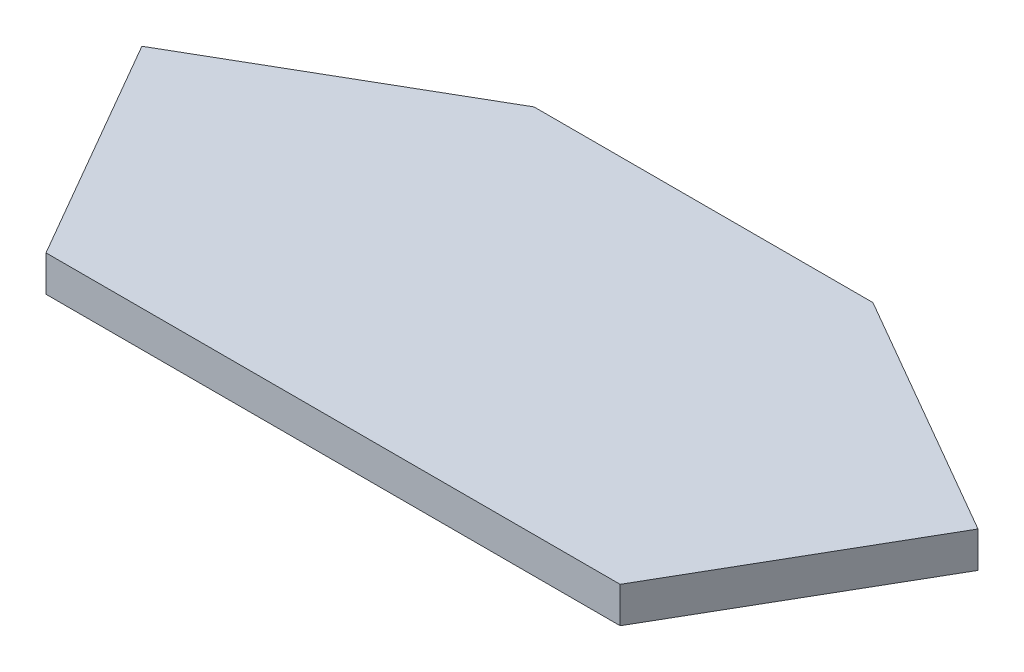
from build123d import *

# Parameters (mm, degrees)
BOSS_EXTRUDE1_DEPTH = 10


with BuildPart() as part:
    # Sketch1 → Boss-Extrude1 (new body)
    with BuildSketch(Plane(origin=(0, 0, 0), x_dir=(1, 0, 0), z_dir=(0, 1, 0))):
        Polygon((-80, 0), (80, 0), (116.5, 63.219854476), (47.217967697, 103.219854476), (-47.217967697, 103.219854476), (-116.5, 63.219854476), align=None)
    extrude(amount=BOSS_EXTRUDE1_DEPTH)


solid = part.part
